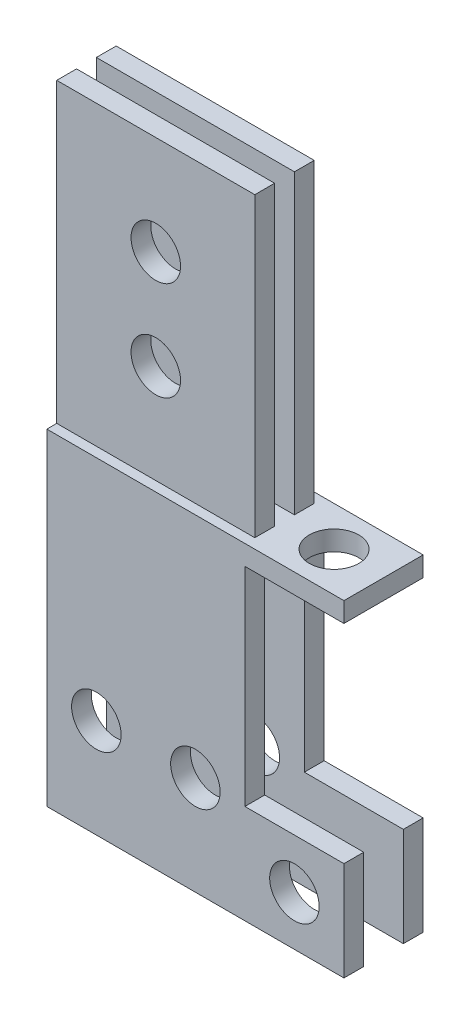
from build123d import *

# Parameters (mm, degrees)
LIP_DEPTH       = 4
LIP_DEPTH_BACK  = 4
SKETCH1_W       = 20
SKETCH1_H       = 3
SIDE1_START     = 2
SKETCH1_3_R     = 2.5
SIDE1_DEPTH     = 2
SKETCH2_W       = 10
SKETCH2_H       = 8
SKETCH2_R       = 2.5
ZIP2_HOLE_DEPTH = 2
SIDE2_START     = -4
SKETCH1_4_R     = 2.5
SIDE2_DEPTH     = 2
GRABBER_START   = 1
SKETCH1_5_W     = 20
SKETCH1_5_H     = 30
SKETCH1_5_R     = 2.5
GRABBER_DEPTH   = 2
GRABBER_START_2 = -3
SKETCH1_6_W     = 20
SKETCH1_6_H     = 30
SKETCH1_6_R     = 2.5
GRABBER_2_DEPTH = 2


with BuildPart() as part:
    # Sketch1 → Lip (new, two sides: drawn at the far end of the back side and taken through both)
    with BuildSketch(Plane.XY.offset(-LIP_DEPTH_BACK)):
        with Locations((-24.8418229, 36.314477682)):
            Rectangle(SKETCH1_W, SKETCH1_H)
    extrude(amount=LIP_DEPTH + LIP_DEPTH_BACK)

    # Sketch1<3> → Side1 (add)
    with BuildSketch(Plane.XY.offset(SIDE1_START)):
        Polygon((-14.8418229, 34.814477682), (-34.8418229, 34.814477682), (-34.8418229, 4.814477682), (-4.8418229, 4.814477682), (-4.8418229, 14.814477682), (-14.8418229, 14.814477682), align=None)
        with Locations((-29.8418229, 14.814477682)):
            Circle(SKETCH1_3_R, mode=Mode.SUBTRACT)
        with Locations((-19.8418229, 14.814477682)):
            Circle(SKETCH1_3_R, mode=Mode.SUBTRACT)
        with Locations((-9.8418229, 9.814477682)):
            Circle(SKETCH1_3_R, mode=Mode.SUBTRACT)
    extrude(amount=SIDE1_DEPTH)

    # Sketch2 → Zip2 Hole (add)
    with BuildSketch(Plane(origin=(0, 37.814477682, 0), x_dir=(1, 0, 0), z_dir=(0, 1, 0))):
        with Locations((-9.8418229, 0)):
            Rectangle(SKETCH2_W, SKETCH2_H)
        with Locations((-9.8418229, 0)):
            Circle(SKETCH2_R, mode=Mode.SUBTRACT)
    extrude(amount=-ZIP2_HOLE_DEPTH)

    # Sketch1<4> → Side2 (add)
    with BuildSketch(Plane.XY.offset(SIDE2_START)):
        Polygon((-14.8418229, 34.814477682), (-34.8418229, 34.814477682), (-34.8418229, 4.814477682), (-4.8418229, 4.814477682), (-4.8418229, 14.814477682), (-14.8418229, 14.814477682), align=None)
        with Locations((-29.8418229, 14.814477682)):
            Circle(SKETCH1_4_R, mode=Mode.SUBTRACT)
        with Locations((-19.8418229, 14.814477682)):
            Circle(SKETCH1_4_R, mode=Mode.SUBTRACT)
    extrude(amount=SIDE2_DEPTH)

    # Sketch1<5> → Grabber (add)
    with BuildSketch(Plane.XY.offset(GRABBER_START)):
        with Locations((-24.8418229, 52.814477682)):
            Rectangle(SKETCH1_5_W, SKETCH1_5_H)
        with Locations((-24.8418229, 47.814477682)):
            Circle(SKETCH1_5_R, mode=Mode.SUBTRACT)
        with Locations((-24.8418229, 57.814477682)):
            Circle(SKETCH1_5_R, mode=Mode.SUBTRACT)
    extrude(amount=GRABBER_DEPTH)

    # Sketch1<6> → Grabber 2 (add)
    with BuildSketch(Plane.XY.offset(GRABBER_START_2)):
        with Locations((-24.8418229, 52.814477682)):
            Rectangle(SKETCH1_6_W, SKETCH1_6_H)
        with Locations((-24.8418229, 47.814477682)):
            Circle(SKETCH1_6_R, mode=Mode.SUBTRACT)
        with Locations((-24.8418229, 57.814477682)):
            Circle(SKETCH1_6_R, mode=Mode.SUBTRACT)
    extrude(amount=GRABBER_2_DEPTH)


solid = part.part
